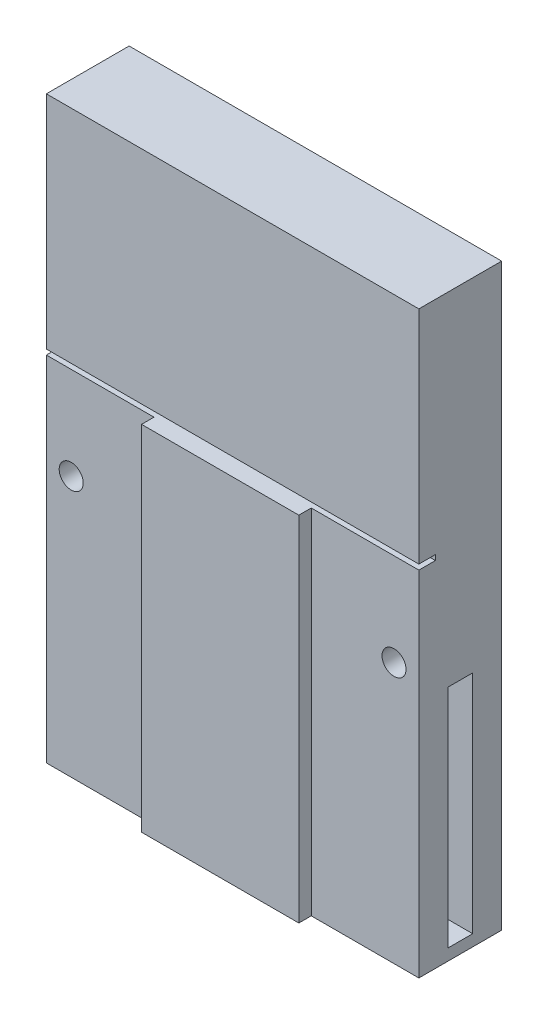
from build123d import *

# Parameters (mm, degrees)
SKETCH2_W           = 45
SKETCH2_H           = 10
BOSS_EXTRUDE1_DEPTH = 40
SKETCH4_W           = 45
SKETCH4_H           = 10
BOSS_EXTRUDE2_DEPTH = 10
SKETCH8_W           = 45
SKETCH8_H           = 10
BOSS_EXTRUDE3_DEPTH = 20
SKETCH9_R           = 1.45
CUT_EXTRUDE2_DEPTH  = 20
SKETCH10_W          = 45
SKETCH10_H          = 0.626165357
CUT_EXTRUDE3_DEPTH  = 2
SKETCH11_W          = 19
SKETCH11_H          = 42.671327575
BOSS_EXTRUDE4_DEPTH = 1.5
SKETCH12_W          = 3
SKETCH12_H          = 27.286335608
CUT_EXTRUDE6_DEPTH  = 10


with BuildPart() as part:
    # Sketch2 → Boss-Extrude1 (new body)
    with BuildSketch(Plane(origin=(0, 0, 0), x_dir=(1, 0, 0), z_dir=(0, 1, 0))):
        Rectangle(SKETCH2_W, SKETCH2_H)
    extrude(amount=BOSS_EXTRUDE1_DEPTH)

    # Sketch4 → Boss-Extrude2 (add)
    with BuildSketch(Plane(origin=(0, 40, 0), x_dir=(1, 0, 0), z_dir=(0, 1, 0))):
        Rectangle(SKETCH4_W, SKETCH4_H)
    extrude(amount=BOSS_EXTRUDE2_DEPTH)

    # Sketch8 → Boss-Extrude3 (add)
    with BuildSketch(Plane.XZ):
        Rectangle(SKETCH8_W, SKETCH8_H)
    extrude(amount=BOSS_EXTRUDE3_DEPTH)

    # Sketch9 → Cut-Extrude2 (cut)
    with BuildSketch(Plane.XY.offset(5)):
        with Locations((19.5, 11.5)):
            Circle(SKETCH9_R)
        with Locations((-19.5, 11.5)):
            Circle(SKETCH9_R)
    extrude(amount=-CUT_EXTRUDE2_DEPTH, mode=Mode.SUBTRACT)

    # Sketch10 → Cut-Extrude3 (cut)
    with BuildSketch(Plane.XY.offset(5)):
        with Locations((0, 22.984410254)):
            Rectangle(SKETCH10_W, SKETCH10_H)
    extrude(amount=-CUT_EXTRUDE3_DEPTH, mode=Mode.SUBTRACT)

    # Sketch11 → Boss-Extrude4 (add)
    with BuildSketch(Plane.XY.offset(5)):
        with Locations((0, 1.335663788)):
            Rectangle(SKETCH11_W, SKETCH11_H)
    extrude(amount=BOSS_EXTRUDE4_DEPTH)

    # Sketch12 → Cut-Extrude6 (cut)
    with BuildSketch(Plane(origin=(22.5, 0, 0), x_dir=(0, 0, -1), z_dir=(1, 0, 0))):
        with Locations((0, -4.971840229)):
            Rectangle(SKETCH12_W, SKETCH12_H)
    extrude(amount=-CUT_EXTRUDE6_DEPTH, mode=Mode.SUBTRACT)


solid = part.part
